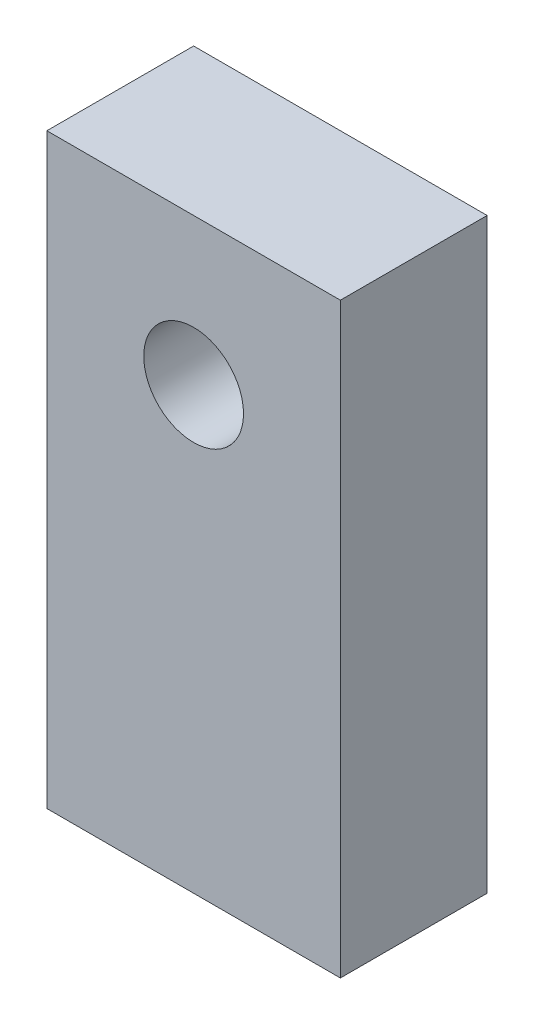
from build123d import *

# Parameters (mm, degrees)
SKETCH1_W               = 30
SKETCH1_H               = 60
BOSS_EXTRUDE1_DEPTH     = 7.5
CUT_EXTRUDE1_DEPTH      = 49.023431781
CUT_EXTRUDE1_DEPTH_BACK = 49.023431781
SKETCH2_R               = 5.1


with BuildPart() as part:
    # Sketch1 → Boss-Extrude1 (new, symmetric)
    with BuildSketch(Plane.XY):
        with Locations((0, -15)):
            Rectangle(SKETCH1_W, SKETCH1_H)
    extrude(amount=BOSS_EXTRUDE1_DEPTH, both=True)

    # Sketch2 → Cut-Extrude1 (cut, two sides: drawn at the far end of the back side and taken through both)
    with BuildSketch(Plane.XY.offset(-CUT_EXTRUDE1_DEPTH_BACK)):
        Circle(SKETCH2_R)
    extrude(amount=CUT_EXTRUDE1_DEPTH + CUT_EXTRUDE1_DEPTH_BACK, mode=Mode.SUBTRACT)


solid = part.part
